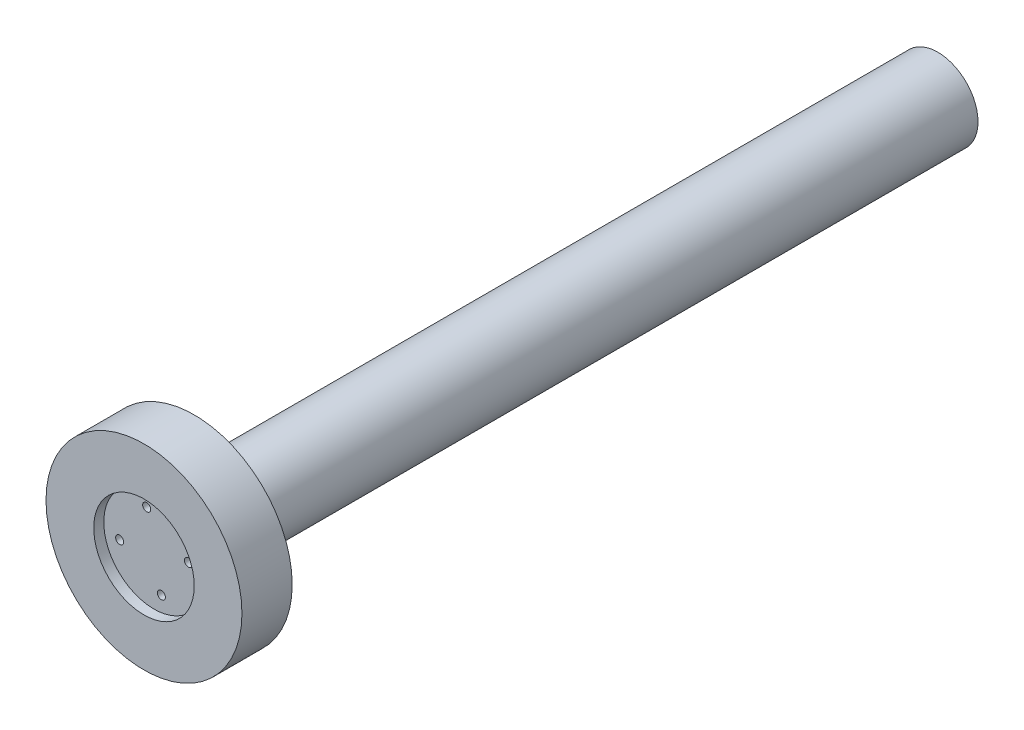
from build123d import *

# Parameters (mm, degrees)
SKETCH1_R           = 8
BOSS_EXTRUDE1_DEPTH = 158
SKETCH2_R           = 19.5
BOSS_EXTRUDE2_DEPTH = 10
SKETCH3_R           = 10
SKETCH3_R_2         = 0.8
CUT_EXTRUDE1_DEPTH  = 2
SKETCH3_2_R         = 0.8
CUT_EXTRUDE2_DEPTH  = 8


with BuildPart() as part:
    # Sketch1 → Boss-Extrude1 (new body)
    with BuildSketch(Plane.XY):
        Circle(SKETCH1_R)
    extrude(amount=BOSS_EXTRUDE1_DEPTH)

    # Sketch2 → Boss-Extrude2 (add)
    with BuildSketch(Plane.XY.offset(158)):
        Circle(SKETCH2_R)
    extrude(amount=-BOSS_EXTRUDE2_DEPTH)

    # Sketch3 → Cut-Extrude1 (cut)
    with BuildSketch(Plane.XY.offset(158)):
        Circle(SKETCH3_R)
        with Locations((6.84496079, 1.465097875)):
            Circle(SKETCH3_R_2, mode=Mode.SUBTRACT)
        with Locations((-1.465097875, 6.84496079)):
            Circle(SKETCH3_R_2, mode=Mode.SUBTRACT)
        with Locations((-6.84496079, -1.465097875)):
            Circle(SKETCH3_R_2, mode=Mode.SUBTRACT)
        with Locations((1.465097875, -6.84496079)):
            Circle(SKETCH3_R_2, mode=Mode.SUBTRACT)
    extrude(amount=-CUT_EXTRUDE1_DEPTH, mode=Mode.SUBTRACT)

    # Sketch3<2> → Cut-Extrude2 (cut)
    with BuildSketch(Plane.XY.offset(158)):
        with Locations((6.84496079, 1.465097875)):
            Circle(SKETCH3_2_R)
        with Locations((-1.465097875, 6.84496079)):
            Circle(SKETCH3_2_R)
        with Locations((-6.84496079, -1.465097875)):
            Circle(SKETCH3_2_R)
        with Locations((1.465097875, -6.84496079)):
            Circle(SKETCH3_2_R)
    extrude(amount=-CUT_EXTRUDE2_DEPTH, mode=Mode.SUBTRACT)


solid = part.part
